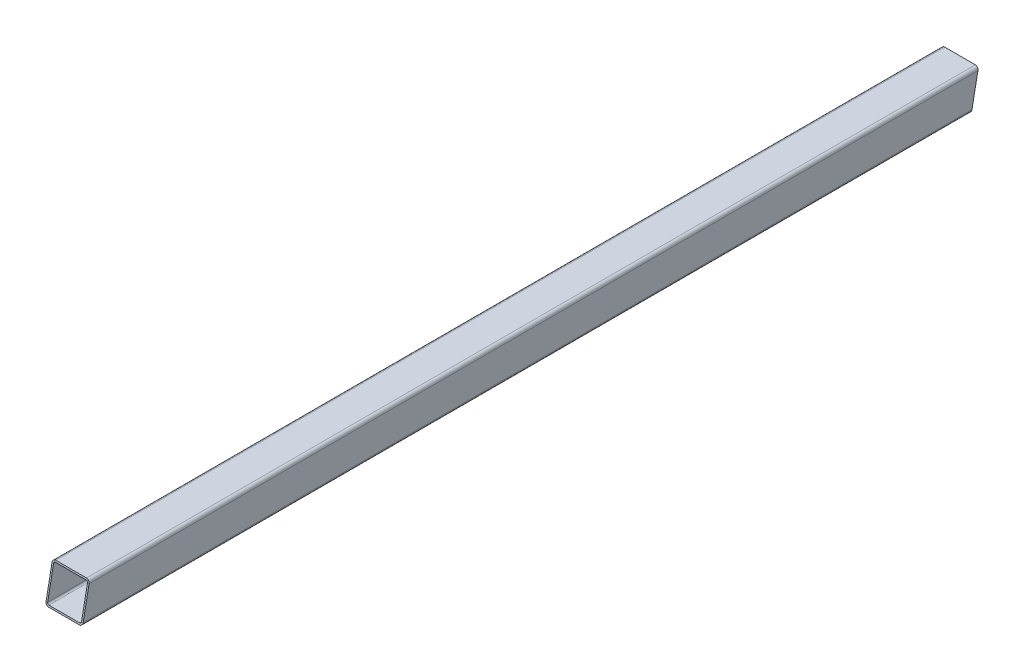
from build123d import *

# Parameters (mm, degrees)
BOSS_EXTRUDE1_DEPTH = 1693
CUT_EXTRUDE1_DEPTH  = 1214


with BuildPart() as part:
    # Sketch1 → Boss-Extrude1 (new body)
    with BuildSketch(Plane.XY):
        with BuildLine():
            Line((17.467048711, 37.014326648), (-40.532951289, 37.014326648))
            ThreePointArc((-40.532951289, 37.014326648), (-44.775591977, 35.256967335), (-46.532951289, 31.014326648))
            Line((-46.532951289, 31.014326648), (-46.532951289, -26.985673352))
            ThreePointArc((-46.532951289, -26.985673352), (-44.775591977, -31.22831404), (-40.532951289, -32.985673352))
            Line((-40.532951289, -32.985673352), (17.467048711, -32.985673352))
            ThreePointArc((17.467048711, -32.985673352), (21.709689398, -31.22831404), (23.467048711, -26.985673352))
            Line((23.467048711, -26.985673352), (23.467048711, 31.014326648))
            ThreePointArc((23.467048711, 31.014326648), (21.709689398, 35.256967335), (17.467048711, 37.014326648))
        make_face()
        with BuildLine():
            Line((17.467048711, 34.014326648), (-40.532951289, 34.014326648))
            ThreePointArc((-40.532951289, 34.014326648), (-42.654271633, 33.135646991), (-43.532951289, 31.014326648))
            Line((-43.532951289, 31.014326648), (-43.532951289, -26.985673352))
            ThreePointArc((-43.532951289, -26.985673352), (-42.654271633, -29.106993696), (-40.532951289, -29.985673352))
            Line((-40.532951289, -29.985673352), (17.467048711, -29.985673352))
            ThreePointArc((17.467048711, -29.985673352), (19.588369054, -29.106993696), (20.467048711, -26.985673352))
            Line((20.467048711, -26.985673352), (20.467048711, 31.014326648))
            ThreePointArc((20.467048711, 31.014326648), (19.588369054, 33.135646991), (17.467048711, 34.014326648))
        make_face(mode=Mode.SUBTRACT)
    extrude(amount=BOSS_EXTRUDE1_DEPTH)

    # Sketch2 → Cut-Extrude1 (cut)
    with BuildSketch(Plane(origin=(23.467048711, 0, 0), x_dir=(0, 0, -1), z_dir=(1, 0, 0))):
        Polygon((0, -32.985673352), (-13.6, -32.985673352), (0, 37.014326648), align=None)
        Polygon((-1679.4, 37.014326648), (-1693, 37.014326648), (-1693, -32.985673352), align=None)
    extrude(amount=-CUT_EXTRUDE1_DEPTH, mode=Mode.SUBTRACT)


solid = part.part
